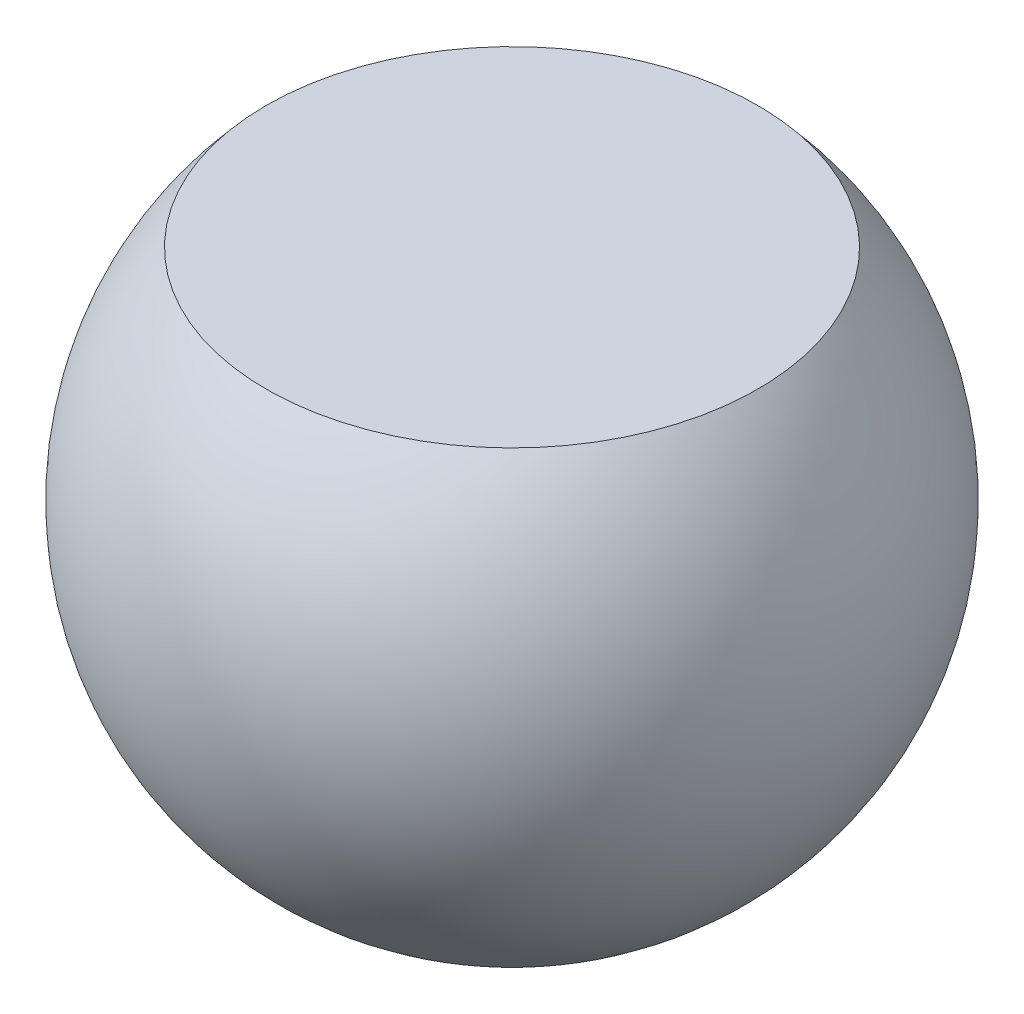
from build123d import *


with BuildPart() as part:
    # 草图1 → 旋转1 (revolve)
    with BuildSketch(Plane.XY, mode=Mode.PRIVATE) as revolve_1_sk:
        with BuildLine():
            Line((0, 6), (6.708203932, 6))
            ThreePointArc((6.708203932, 6), (8.215838363, -3.674234614), (0, -9))
            Line((0, -9), (0, 6))
        make_face()
    revolve(revolve_1_sk.sketch.rotate(Axis((0, 6, 0), (0, -1, 0)), 180), axis=Axis((0, 6, 0), (0, -1, 0)))


solid = part.part
